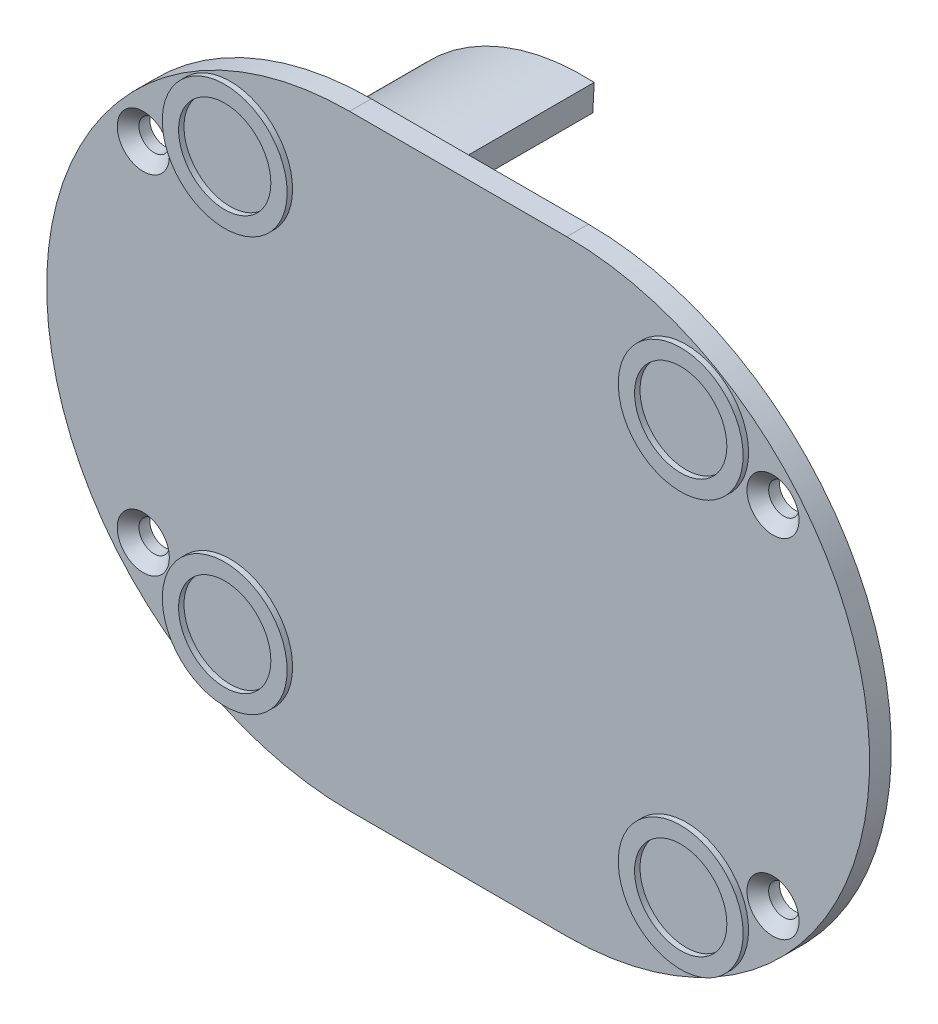
from build123d import *

# Parameters (mm, degrees)
EXTRUDE_1_DEPTH           = 2
HOLE_WIZARD_1_D           = 2.8
HOLE_WIZARD_1_DEPTH       = 7.5
HOLE_WIZARD_1_CSINK_D     = 4.8
HOLE_WIZARD_1_CSINK_ANGLE = 90
HOLE_WIZARD_1_TIP         = 0.841204867
SKETCH_4_R                = 5.75
SKETCH_4_R_2              = 4.25
EXTRUDE_1_2_DEPTH         = 0.5
EXTRUDE_2_DEPTH           = 21.5
CHAMFER_1_SIZE            = 2


with BuildPart() as part:
    # 草图1 → Extrude 1 (new body)
    with BuildSketch(Plane.XY):
        with BuildLine():
            Line((-20, -27.9), (0, -27.9))
            ThreePointArc((0, -27.9), (27.9, 0), (0, 27.9))
            Line((0, 27.9), (-20, 27.9))
            ThreePointArc((-20, 27.9), (-47.9, 0), (-20, -27.9))
        make_face()
    extrude(amount=EXTRUDE_1_DEPTH)

    # 打孔尺寸(%根据十字)槽沉头自攻螺钉的类型1
    with Locations(Plane.XY.offset(2)):
        with Locations((-39, 16), (-39, -16), (19, 16), (19, -16), (-60.528138983, 2.67584761), (-55.747291253, 1.462796694)):
            CounterSinkHole(HOLE_WIZARD_1_D / 2, HOLE_WIZARD_1_CSINK_D / 2, depth=HOLE_WIZARD_1_DEPTH, counter_sink_angle=HOLE_WIZARD_1_CSINK_ANGLE)
            with Locations((0, 0, -(HOLE_WIZARD_1_DEPTH + HOLE_WIZARD_1_TIP / 2))):  # 118° drill point
                Cone(0, HOLE_WIZARD_1_D / 2, HOLE_WIZARD_1_TIP, mode=Mode.SUBTRACT)

    # 草图4 → Extrude 1 2 (add)
    # profile 1 of 4: a face of its own
    with BuildSketch(Plane.XY.offset(2)):
        with Locations((11, -19.052558883)):
            Circle(SKETCH_4_R)
        with Locations((11, -19.052558883)):
            Circle(SKETCH_4_R_2, mode=Mode.SUBTRACT)
    # profile 2 of 4: a face of its own
    with BuildSketch(Plane.XY.offset(2)):
        with Locations((11, 19.052558883)):
            Circle(SKETCH_4_R)
        with Locations((11, 19.052558883)):
            Circle(SKETCH_4_R_2, mode=Mode.SUBTRACT)
    # profile 3 of 4: a face of its own
    with BuildSketch(Plane.XY.offset(2)):
        with Locations((-31, 19.052558883)):
            Circle(SKETCH_4_R)
        with Locations((-31, 19.052558883)):
            Circle(SKETCH_4_R_2, mode=Mode.SUBTRACT)
    # profile 4 of 4: a face of its own
    with BuildSketch(Plane.XY.offset(2)):
        with Locations((-31, -19.052558883)):
            Circle(SKETCH_4_R)
        with Locations((-31, -19.052558883)):
            Circle(SKETCH_4_R_2, mode=Mode.SUBTRACT)
    extrude(amount=EXTRUDE_1_2_DEPTH)

    # 草图5 → 拉伸-薄壁2 (add)
    with BuildSketch(Plane.XY.offset(2)):
        with BuildLine():
            ThreePointArc((-38.933849158, 6.442775494), (-31.220488522, 16.55598494), (-18.969199414, 19.973418589))
            Line((-18.969199414, 19.973418589), (-19.098049487, 17.476741266))
            ThreePointArc((-19.098049487, 17.476741266), (-29.817927457, 14.486486822), (-36.567118013, 5.637428557))
            Line((-36.567118013, 5.637428557), (-38.933849158, 6.442775494))
        make_face()
    extrude(amount=-EXTRUDE_2_DEPTH)

    # 倒角1
    chamfer_1_edges = [part.edges().sort_by_distance(p)[0] for p in [
        (-31.220488522, 16.55598494, 0),
        (-29.817927457, 14.486486822, 0),
    ]]
    chamfer(chamfer_1_edges, length=CHAMFER_1_SIZE)


solid = part.part
